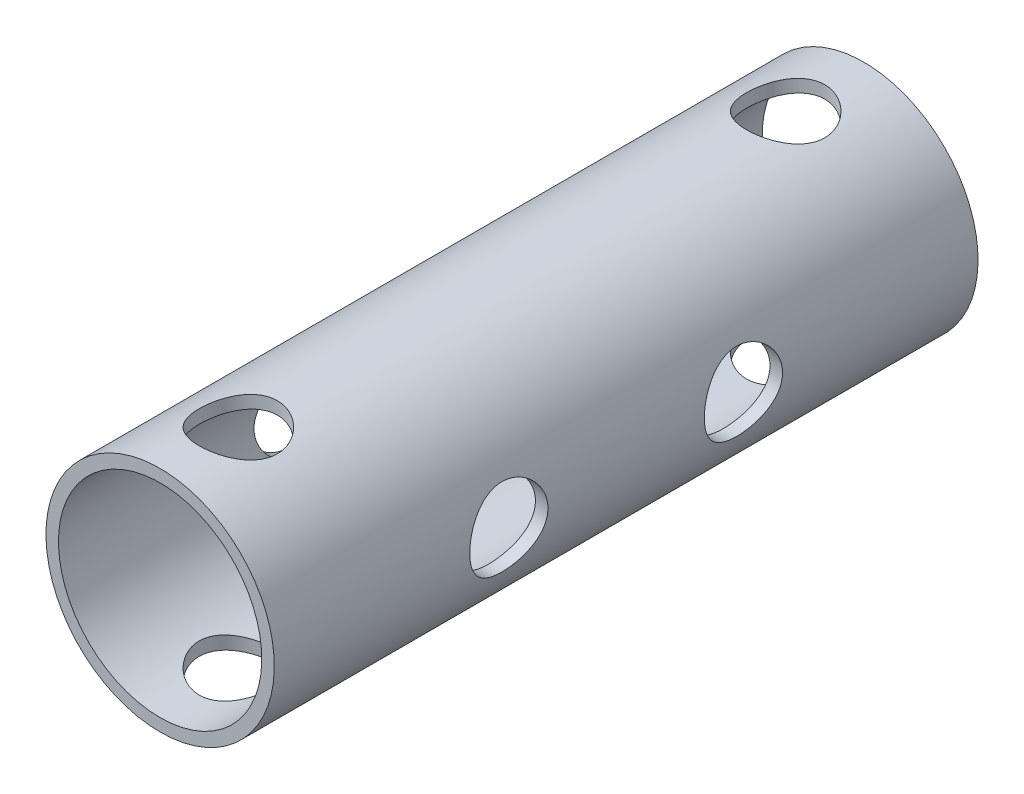
from build123d import *

# Parameters (mm, degrees)
SKETCH1_R               = 14.6
SKETCH1_R_2             = 13
PIPE_25_4_X_1_6_2_DEPTH = 90
SKETCH16_R              = 5
CUT_EXTRUDE4_DEPTH      = 30
SKETCH17_R              = 5
CUT_EXTRUDE5_DEPTH      = 30


with BuildPart() as part:
    # Sketch1 → Pipe 25.4 X 1.6(2) (new body)
    with BuildSketch(Plane(origin=(0, 0, -45), x_dir=(0, -1, 0), z_dir=(0, 0, 1))):
        Circle(SKETCH1_R)
        Circle(SKETCH1_R_2, mode=Mode.SUBTRACT)
    extrude(amount=PIPE_25_4_X_1_6_2_DEPTH)

    # Sketch16 → Cut-Extrude4 (cut, symmetric)
    with BuildSketch(Plane(origin=(0, 0, 0), x_dir=(0, 0, -1), z_dir=(1, 0, 0))):
        with Locations((-15, 0)):
            Circle(SKETCH16_R)
        with Locations((15, 0)):
            Circle(SKETCH16_R)
    extrude(amount=CUT_EXTRUDE4_DEPTH, both=True, mode=Mode.SUBTRACT)

    # Sketch17 → Cut-Extrude5 (cut, symmetric)
    with BuildSketch(Plane(origin=(0, 0, 0), x_dir=(1, 0, 0), z_dir=(0, 1, 0))):
        with Locations(Location((0, -35, 0), (0, 0, 270))):
            Circle(SKETCH17_R)
        with Locations(Location((0, 35, 0), (0, 0, 270))):
            Circle(SKETCH17_R)
    extrude(amount=CUT_EXTRUDE5_DEPTH, both=True, mode=Mode.SUBTRACT)


solid = part.part
